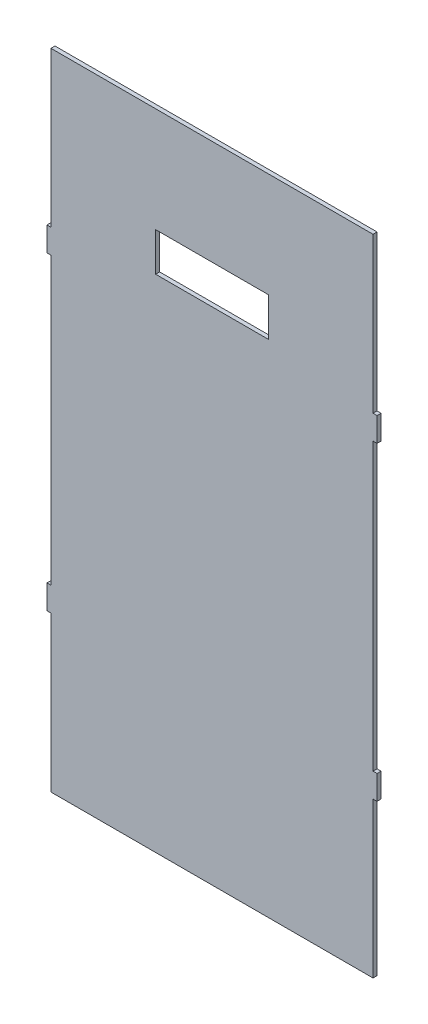
from build123d import *

# Parameters (mm, degrees)
BOSS_EXTRU_1_DEPTH      = 5
ESQUISSE2_W             = 140
ESQUISSE2_H             = 48
ENL_V_MAT_EXTRU_1_DEPTH = 450.499721913


with BuildPart() as part:
    # Esquisse1 → Boss.-Extru.1 (new body)
    with BuildSketch(Plane.XY):
        Polygon((-200, 400), (200, 400), (200, 207.5), (205, 207.5), (205, 177.5), (200, 177.5), (200, -177.5), (205, -177.5), (205, -207.5), (200, -207.5), (200, -400), (-200, -400), (-200, -207.5), (-205, -207.5), (-205, -177.5), (-200, -177.5), (-200, 177.5), (-205, 177.5), (-205, 207.5), (-200, 207.5), align=None)
    extrude(amount=BOSS_EXTRU_1_DEPTH)

    # Esquisse2 → Enlèv. mat.-Extru.1 (cut, through all)
    with BuildSketch(Plane.XY.offset(5)):
        with Locations((0, 246)):
            Rectangle(ESQUISSE2_W, ESQUISSE2_H)
    extrude(amount=-ENL_V_MAT_EXTRU_1_DEPTH, mode=Mode.SUBTRACT)


solid = part.part
